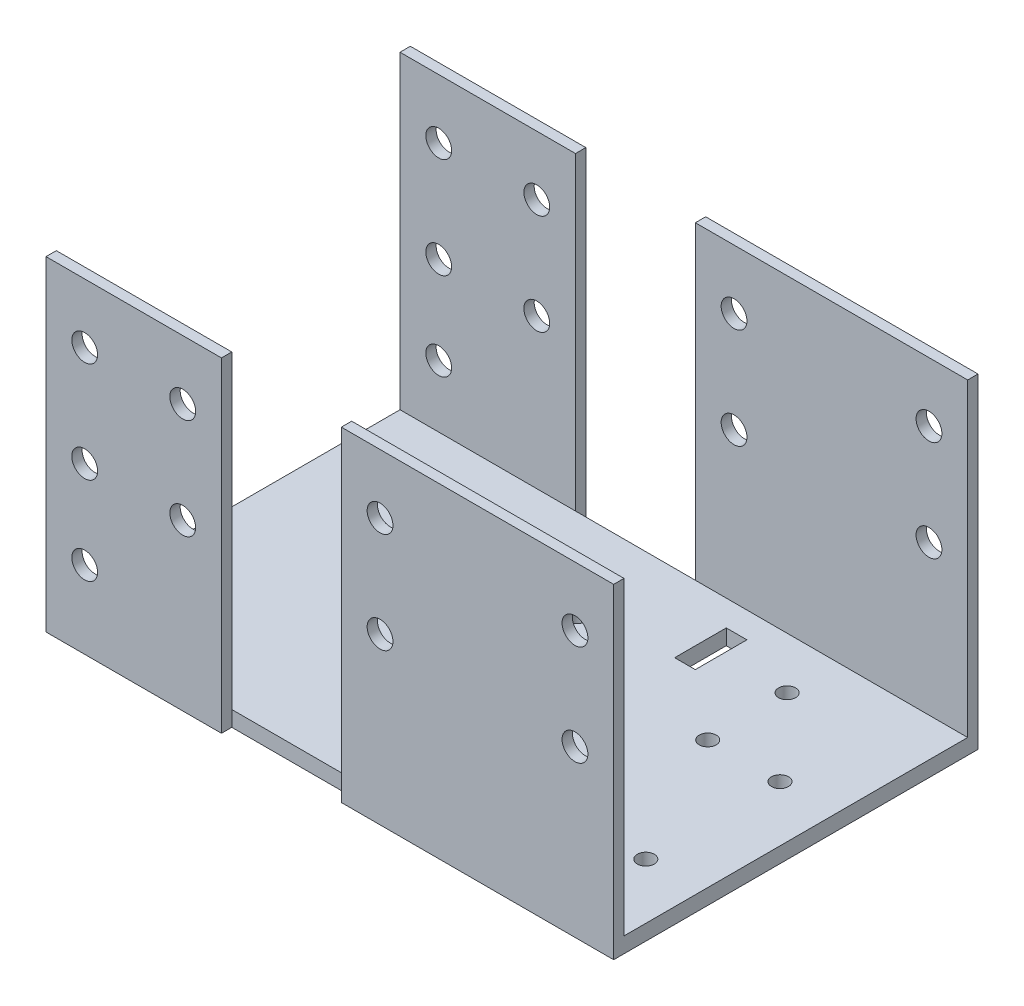
from build123d import *

# Parameters (mm, degrees)
SKETCH_1_R               = 1.65
SKETCH_1_W               = 14
SKETCH_1_H               = 4
SKETCH_1_W_2             = 4
SKETCH_1_H_2             = 10
EXTRUDE_2_DEPTH          = 3
SKETCH_1_3_W             = 34
SKETCH_1_3_H             = 2
SKETCH_1_3_W_2           = 52.77
EXTRUDE_3_DEPTH          = 63
CUT_EXTRUDE_1_DEPTH      = 146.097760148
CUT_EXTRUDE_1_DEPTH_BACK = 146.097760148
SKETCH_2_R               = 2.5
CUT_EXTRUDE_2_DEPTH      = 146.097760148
CUT_EXTRUDE_2_DEPTH_BACK = 146.097760148
SKETCH_4_R               = 2.5


with BuildPart() as part:
    # 草图1 → 凸台-拉伸2 (new body)
    with BuildSketch(Plane(origin=(0, 0, 0), x_dir=(1, 0, 0), z_dir=(0, 1, 0))):
        Polygon((34, 0), (0, 0), (0, -66.6), (34, -66.6), (57.23, -66.6), (110, -66.6), (110, 0), (57.23, 0), align=None)
        with Locations((11.386101665, -59.551846161)):
            Circle(SKETCH_1_R, mode=Mode.SUBTRACT)
        with Locations((53.38610037, -59.562276184)):
            Circle(SKETCH_1_R, mode=Mode.SUBTRACT)
        with Locations((92.227995582, -61.561806958)):
            Rectangle(SKETCH_1_W, SKETCH_1_H, mode=Mode.SUBTRACT)
        with Locations((85.227995582, -51.6)):
            Circle(SKETCH_1_R, mode=Mode.SUBTRACT)
        with Locations((99.227995582, -51.6)):
            Circle(SKETCH_1_R, mode=Mode.SUBTRACT)
        with Locations((9.892625589, -17.551846161)):
            Circle(SKETCH_1_R, mode=Mode.SUBTRACT)
        with Locations((51.892625589, -17.562276184)):
            Circle(SKETCH_1_R, mode=Mode.SUBTRACT)
        with Locations((85.227995582, -25.6)):
            Circle(SKETCH_1_R, mode=Mode.SUBTRACT)
        with Locations((99.227995582, -25.6)):
            Circle(SKETCH_1_R, mode=Mode.SUBTRACT)
        with Locations((70.219502327, -10)):
            Rectangle(SKETCH_1_W_2, SKETCH_1_H_2, mode=Mode.SUBTRACT)
        with Locations((85, -10)):
            Circle(SKETCH_1_R, mode=Mode.SUBTRACT)
    extrude(amount=EXTRUDE_2_DEPTH)

    # 草图1<3> → 凸台-拉伸3 (add)
    with BuildSketch(Plane(origin=(0, 0, 0), x_dir=(1, 0, 0), z_dir=(0, 1, 0))):
        with Locations((17, -67.6)):
            Rectangle(SKETCH_1_3_W, SKETCH_1_3_H)
        with Locations((83.615, -67.6)):
            Rectangle(SKETCH_1_3_W_2, SKETCH_1_3_H)
        with Locations((17, 1)):
            Rectangle(SKETCH_1_3_W, SKETCH_1_3_H)
        with Locations((83.615, 1)):
            Rectangle(SKETCH_1_3_W_2, SKETCH_1_3_H)
    extrude(amount=EXTRUDE_3_DEPTH)

    # 草图2 → 切除-拉伸1 (cut, two sides: drawn at the far end of the back side and taken through both)
    with BuildSketch(Plane.XY.offset(68.6).offset(-CUT_EXTRUDE_1_DEPTH_BACK)):
        with Locations((64.73, 32)):
            Circle(SKETCH_2_R)
        with Locations((102.5, 32)):
            Circle(SKETCH_2_R)
        with Locations((64.73, 51.5)):
            Circle(SKETCH_2_R)
        with Locations((102.5, 51.5)):
            Circle(SKETCH_2_R)
        with Locations((26.5, 32)):
            Circle(SKETCH_2_R)
        with Locations((7.5, 32)):
            Circle(SKETCH_2_R)
        with Locations((26.5, 51.5)):
            Circle(SKETCH_2_R)
        with Locations((7.5, 51.5)):
            Circle(SKETCH_2_R)
    extrude(amount=CUT_EXTRUDE_1_DEPTH + CUT_EXTRUDE_1_DEPTH_BACK, mode=Mode.SUBTRACT)

    # 草图4 → 切除-拉伸2 (cut, two sides: drawn at the far end of the back side and taken through both)
    with BuildSketch(Plane(origin=(0, 0, -2), x_dir=(-1, 0, 0), z_dir=(0, 0, -1)).offset(-CUT_EXTRUDE_2_DEPTH_BACK)):
        with Locations((-7.5, 15)):
            Circle(SKETCH_4_R)
    extrude(amount=CUT_EXTRUDE_2_DEPTH + CUT_EXTRUDE_2_DEPTH_BACK, mode=Mode.SUBTRACT)


solid = part.part
